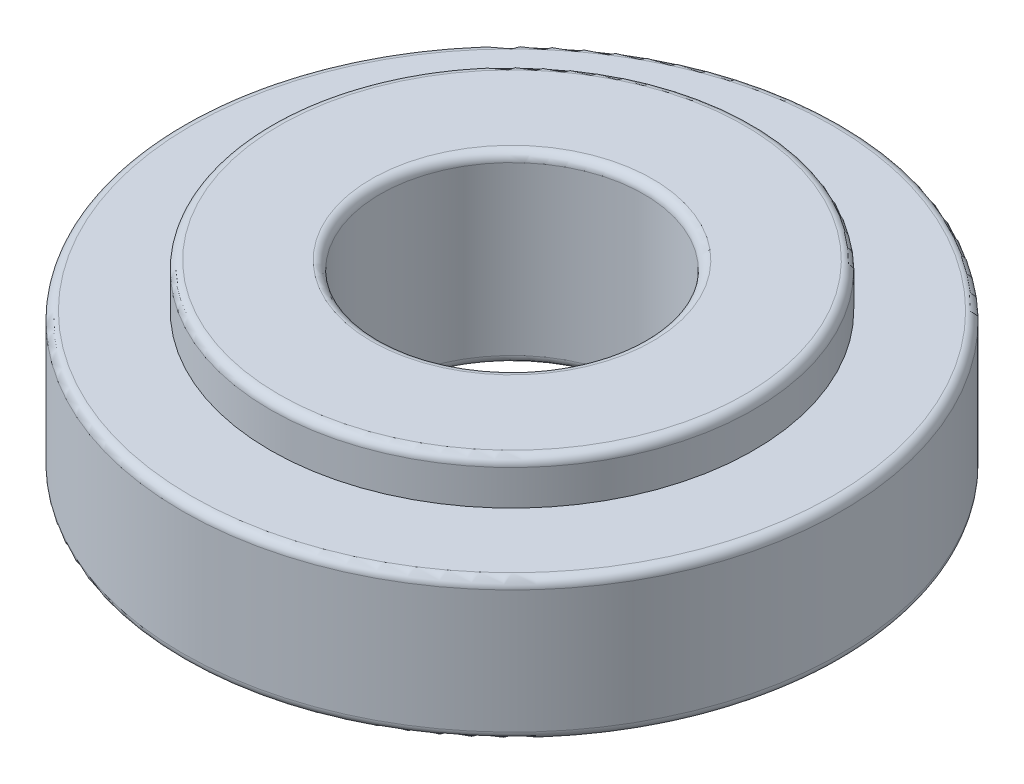
from build123d import *

# Parameters (mm, degrees)
SKETCH_1_R          = 3.75
EXTRUDE_2_DEPTH     = 1.6
SKETCH_2_R          = 1.5
CUT_EXTRUDE_1_DEPTH = 2
SKETCH_3_R          = 2.75
EXTRUDE_3_DEPTH     = 0.5
SKETCH_4_R          = 1.5
CUT_EXTRUDE_2_DEPTH = 3
FILLET_1_R          = 0.1


with BuildPart() as part:
    # 草图1 → 凸台-拉伸2 (new body)
    with BuildSketch(Plane(origin=(0, 0, 0), x_dir=(1, 0, 0), z_dir=(0, 1, 0))):
        with Locations(Location((0, 0, 0), (0, 0, 270))):
            Circle(SKETCH_1_R)
    extrude(amount=EXTRUDE_2_DEPTH)

    # 草图2 → 切除-拉伸1 (cut)
    with BuildSketch(Plane(origin=(0, 1.6, 0), x_dir=(1, 0, 0), z_dir=(0, 1, 0))):
        with Locations(Location((0, 0, 0), (0, 0, 270))):
            Circle(SKETCH_2_R)
    extrude(amount=-CUT_EXTRUDE_1_DEPTH, mode=Mode.SUBTRACT)

    # 草图3 → 凸台-拉伸3 (add)
    with BuildSketch(Plane(origin=(0, 1.6, 0), x_dir=(1, 0, 0), z_dir=(0, 1, 0))):
        with Locations(Location((0, 0, 0), (0, 0, 270))):
            Circle(SKETCH_3_R)
    extrude(amount=EXTRUDE_3_DEPTH)

    # 草图4 → 切除-拉伸2 (cut)
    with BuildSketch(Plane(origin=(0, 2.1, 0), x_dir=(1, 0, 0), z_dir=(0, 1, 0))):
        with Locations(Location((0, 0, 0), (0, 0, 270))):
            Circle(SKETCH_4_R)
    extrude(amount=-CUT_EXTRUDE_2_DEPTH, mode=Mode.SUBTRACT)

    # 圆角1
    fillet_1_edges = [part.edges().sort_by_distance(p)[0] for p in [
        (0, 2.1, -2.75),
        (0, 2.1, -1.5),
        (0, 0, -3.75),
        (0, 1.6, -3.75),
        (0, 0, -1.5),
    ]]
    fillet(fillet_1_edges, radius=FILLET_1_R)


solid = part.part
